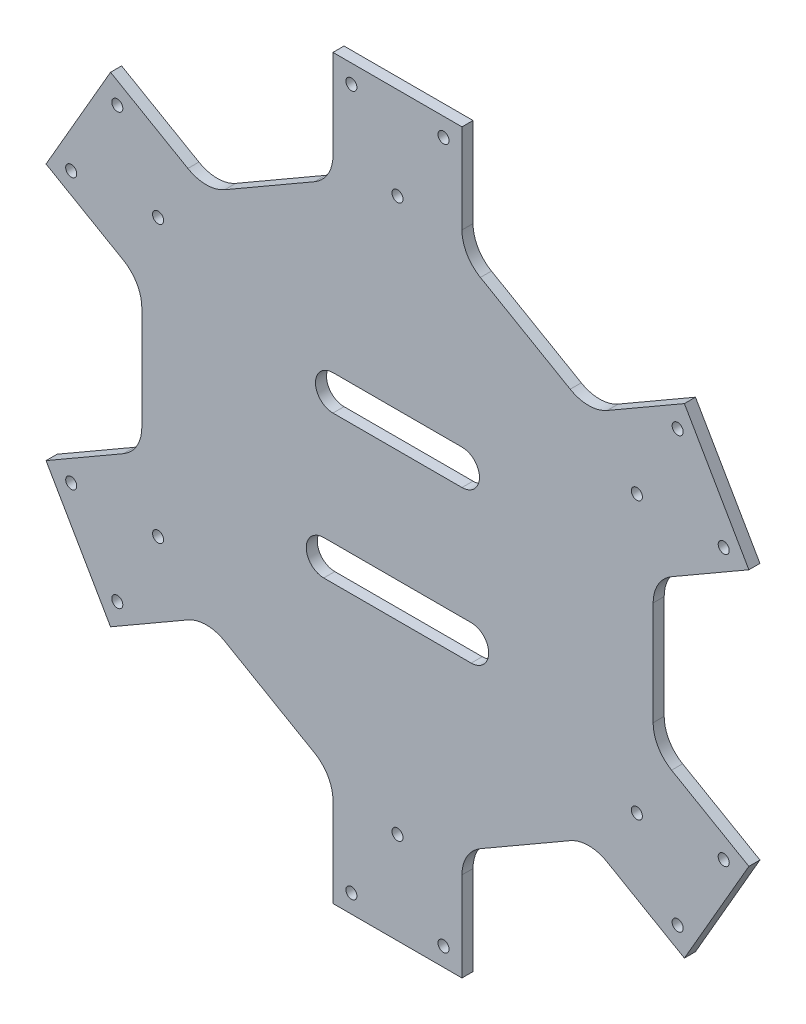
from build123d import *

# Parameters (mm, degrees)
IZIM1_R                     = 1.5
Y_KSEKLIK_EKSTR_ZYON1_DEPTH = 3
KES_EKSTR_ZYON2_DEPTH       = 3


with BuildPart() as part:
    # Çizim1 → Yükseklik-Ekstrüzyon1 (new body)
    with BuildSketch(Plane.XY):
        with BuildLine():
            Line((-17.5, 100), (17.5, 100))
            Line((17.5, 100), (17.5, 75.773502692))
            ThreePointArc((17.5, 75.773502692), (18.839745962, 70.773502692), (22.5, 67.113248654))
            Line((22.5, 67.113248654), (46.871778265, 53.042195912))
            ThreePointArc((46.871778265, 53.042195912), (51.871778265, 51.70244995), (56.871778265, 53.042195912))
            Line((56.871778265, 53.042195912), (77.852540378, 65.155444566))
            Line((77.852540378, 65.155444566), (95.352540378, 34.844555434))
            Line((95.352540378, 34.844555434), (74.371778265, 22.73130678))
            ThreePointArc((74.371778265, 22.73130678), (70.711524227, 19.071052742), (69.371778265, 14.071052742))
            Line((69.371778265, 14.071052742), (69.371778265, -14.071052742))
            ThreePointArc((69.371778265, -14.071052742), (70.711524227, -19.071052742), (74.371778265, -22.73130678))
            Line((74.371778265, -22.73130678), (95.352540378, -34.844555434))
            Line((95.352540378, -34.844555434), (77.852540378, -65.155444566))
            Line((77.852540378, -65.155444566), (56.871778265, -53.042195912))
            ThreePointArc((56.871778265, -53.042195912), (51.871778265, -51.70244995), (46.871778265, -53.042195912))
            Line((46.871778265, -53.042195912), (22.5, -67.113248654))
            ThreePointArc((22.5, -67.113248654), (18.839745962, -70.773502692), (17.5, -75.773502692))
            Line((17.5, -75.773502692), (17.5, -100))
            Line((17.5, -100), (-17.5, -100))
            Line((-17.5, -100), (-17.5, -75.773502692))
            ThreePointArc((-17.5, -75.773502692), (-18.839745962, -70.773502692), (-22.5, -67.113248654))
            Line((-22.5, -67.113248654), (-46.871778265, -53.042195912))
            ThreePointArc((-46.871778265, -53.042195912), (-51.871778265, -51.70244995), (-56.871778265, -53.042195912))
            Line((-56.871778265, -53.042195912), (-77.852540379, -65.155444566))
            Line((-77.852540379, -65.155444566), (-95.352540379, -34.844555434))
            Line((-95.352540379, -34.844555434), (-74.371778265, -22.73130678))
            ThreePointArc((-74.371778265, -22.73130678), (-70.711524227, -19.071052742), (-69.371778265, -14.071052742))
            Line((-69.371778265, -14.071052742), (-69.371778265, 14.071052742))
            ThreePointArc((-69.371778265, 14.071052742), (-70.711524227, 19.071052742), (-74.371778265, 22.73130678))
            Line((-74.371778265, 22.73130678), (-95.352540378, 34.844555434))
            Line((-95.352540378, 34.844555434), (-77.852540378, 65.155444566))
            Line((-77.852540378, 65.155444566), (-56.871778265, 53.042195912))
            ThreePointArc((-56.871778265, 53.042195912), (-51.871778265, 51.70244995), (-46.871778265, 53.042195912))
            Line((-46.871778265, 53.042195912), (-22.5, 67.113248654))
            ThreePointArc((-22.5, 67.113248654), (-18.839745962, 70.773502692), (-17.5, 75.773502692))
            Line((-17.5, 75.773502692), (-17.5, 100))
        make_face()
        with Locations((-12.5, 95)):
            Circle(IZIM1_R, mode=Mode.SUBTRACT)
        with Locations((12.5, 95)):
            Circle(IZIM1_R, mode=Mode.SUBTRACT)
        with Locations((0, 75)):
            Circle(IZIM1_R, mode=Mode.SUBTRACT)
        with Locations((76.022413359, 58.325317547)):
            Circle(IZIM1_R, mode=Mode.SUBTRACT)
        with Locations((88.522413359, 36.674682453)):
            Circle(IZIM1_R, mode=Mode.SUBTRACT)
        with Locations((64.951905284, 37.5)):
            Circle(IZIM1_R, mode=Mode.SUBTRACT)
        with Locations((88.522413359, -36.674682453)):
            Circle(IZIM1_R, mode=Mode.SUBTRACT)
        with Locations((76.02241336, -58.325317547)):
            Circle(IZIM1_R, mode=Mode.SUBTRACT)
        with Locations((64.951905284, -37.5)):
            Circle(IZIM1_R, mode=Mode.SUBTRACT)
        with Locations((12.5, -95)):
            Circle(IZIM1_R, mode=Mode.SUBTRACT)
        with Locations((-12.5, -95)):
            Circle(IZIM1_R, mode=Mode.SUBTRACT)
        with Locations((0, -75)):
            Circle(IZIM1_R, mode=Mode.SUBTRACT)
        with Locations((-76.022413359, -58.325317547)):
            Circle(IZIM1_R, mode=Mode.SUBTRACT)
        with Locations((-88.522413359, -36.674682453)):
            Circle(IZIM1_R, mode=Mode.SUBTRACT)
        with Locations((-64.951905284, -37.5)):
            Circle(IZIM1_R, mode=Mode.SUBTRACT)
        with Locations((-88.522413359, 36.674682453)):
            Circle(IZIM1_R, mode=Mode.SUBTRACT)
        with Locations((-76.022413359, 58.325317547)):
            Circle(IZIM1_R, mode=Mode.SUBTRACT)
        with Locations((-64.951905284, 37.5)):
            Circle(IZIM1_R, mode=Mode.SUBTRACT)
    extrude(amount=Y_KSEKLIK_EKSTR_ZYON1_DEPTH)

    # Çizim2 → Kes-Ekstrüzyon2 (cut)
    with BuildSketch(Plane.XY.offset(3)):
        with BuildLine():
            Line((-17.5, 24.75), (17.5, 24.75))
            ThreePointArc((17.5, 24.75), (22.25, 20), (17.5, 15.25))
            Line((17.5, 15.25), (-17.5, 15.25))
            ThreePointArc((-17.5, 15.25), (-22.25, 20), (-17.5, 24.75))
        make_face()
        with BuildLine():
            Line((-20, -15.25), (20, -15.25))
            ThreePointArc((20, -15.25), (24.75, -20), (20, -24.75))
            Line((20, -24.75), (-20, -24.75))
            ThreePointArc((-20, -24.75), (-24.75, -20), (-20, -15.25))
        make_face()
    extrude(amount=-KES_EKSTR_ZYON2_DEPTH, mode=Mode.SUBTRACT)


solid = part.part
